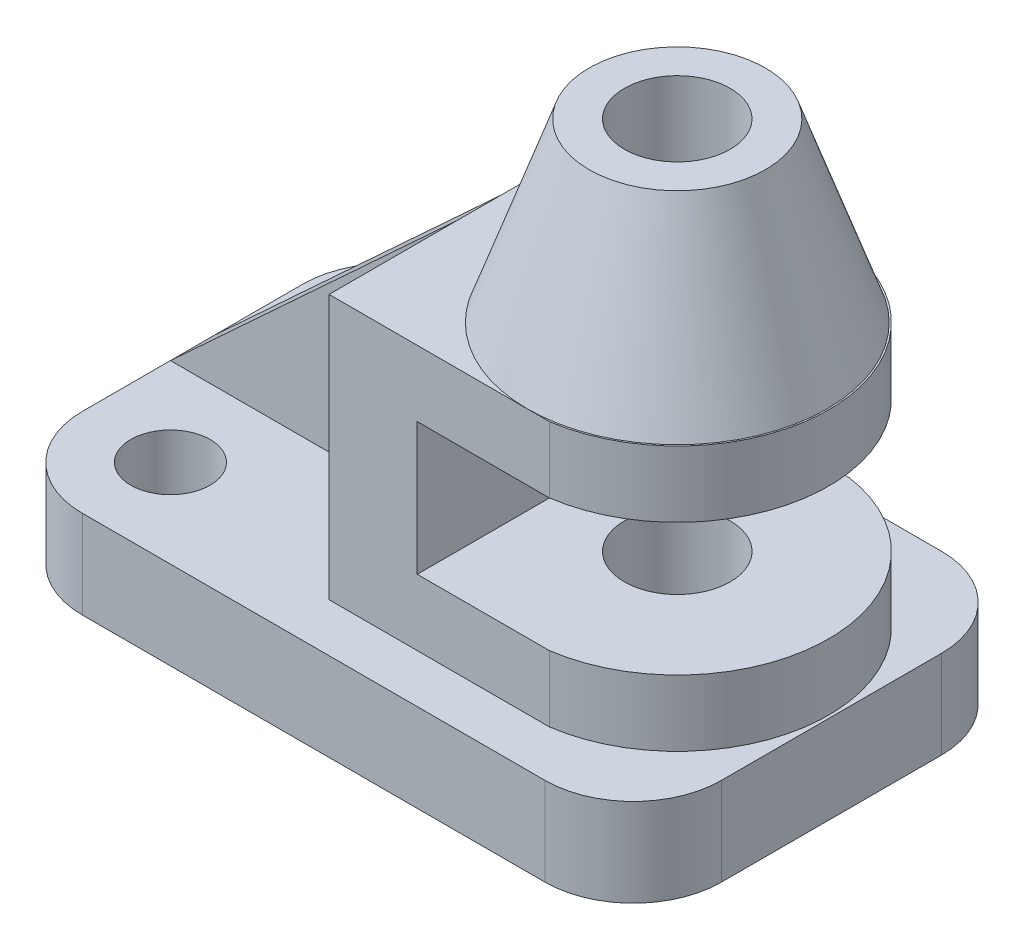
from build123d import *

# Parameters (mm, degrees)
SKETCH1_R           = 9
BOSS_EXTRUDE1_DEPTH = 20
BOSS_EXTRUDE5_DEPTH = 60
BOSS_EXTRUDE8_DEPTH = 60
SKETCH23_R          = 34
SKETCH24_R          = 20
SKETCH25_R          = 12
CUT_EXTRUDE12_DEPTH = 148.245543226
CUT_EXTRUDE13_START = 15
CUT_EXTRUDE13_DEPTH = 30
BOSS_EXTRUDE9_DEPTH = 5


with BuildPart() as part:
    # Sketch1 → Boss-Extrude1 (new body)
    with BuildSketch(Plane(origin=(0, 0, 0), x_dir=(1, 0, 0), z_dir=(0, 1, 0))):
        with BuildLine():
            Line((52.5, 45), (-52.5, 45))
            ThreePointArc((-52.5, 45), (-66.642135624, 39.142135624), (-72.5, 25))
            Line((-72.5, 25), (-72.5, -25))
            ThreePointArc((-72.5, -25), (-66.642135624, -39.142135624), (-52.5, -45))
            Line((-52.5, -45), (52.5, -45))
            ThreePointArc((52.5, -45), (66.642135624, -39.142135624), (72.5, -25))
            Line((72.5, -25), (72.5, 25))
            ThreePointArc((72.5, 25), (66.642135624, 39.142135624), (52.5, 45))
        make_face()
        with Locations((-52.5, 25)):
            Circle(SKETCH1_R, mode=Mode.SUBTRACT)
        with Locations((-52.5, -25)):
            Circle(SKETCH1_R, mode=Mode.SUBTRACT)
    extrude(amount=BOSS_EXTRUDE1_DEPTH)

    # Sketch2 → Boss-Extrude5 (add)
    with BuildSketch(Plane(origin=(0, 20, 0), x_dir=(1, 0, 0), z_dir=(0, 1, 0))):
        Polygon((12.5, 34), (-7.5, 34), (-7.5, 3.870420596), (-7.5, 0), (-7.5, -34), (12.5, -34), align=None)
    extrude(amount=BOSS_EXTRUDE5_DEPTH)

    # Sketch7 → Boss-Extrude8 (add)
    with BuildSketch(Plane(origin=(0, 20, 0), x_dir=(1, 0, 0), z_dir=(0, 1, 0))):
        with BuildLine():
            Line((12.5, -34), (42.5, -34))
            ThreePointArc((42.5, -34), (71.865680555, 0), (42.5, 34))
            Line((42.5, 34), (12.5, 34))
            Line((12.5, 34), (12.5, -34))
        make_face()
    extrude(amount=BOSS_EXTRUDE8_DEPTH)

    # Sketch23 → Loft1 section 0
    with BuildSketch(Plane(origin=(0, 80, 0), x_dir=(1, 0, 0), z_dir=(0, 1, 0))):
        with Locations((37.5, 0)):
            Circle(SKETCH23_R)
    # Sketch24 → Loft1 section 1
    with BuildSketch(Plane(origin=(0, 120, 0), x_dir=(1, 0, 0), z_dir=(0, 1, 0))):
        with Locations((37.5, 0)):
            Circle(SKETCH24_R)
    loft()

    # Sketch25 → Cut-Extrude12 (cut, through all)
    with BuildSketch(Plane(origin=(0, 120, 0), x_dir=(1, 0, 0), z_dir=(0, 1, 0))):
        with Locations((37.5, 0)):
            Circle(SKETCH25_R)
    extrude(amount=-CUT_EXTRUDE12_DEPTH, mode=Mode.SUBTRACT)

    # Sketch7<2> → Cut-Extrude13 (cut)
    with BuildSketch(Plane(origin=(0, 20, 0), x_dir=(1, 0, 0), z_dir=(0, 1, 0)).offset(CUT_EXTRUDE13_START)):
        with BuildLine():
            Line((12.5, -34), (42.5, -34))
            ThreePointArc((42.5, -34), (71.865680555, 0), (42.5, 34))
            Line((42.5, 34), (12.5, 34))
            Line((12.5, 34), (12.5, -34))
        make_face()
    extrude(amount=CUT_EXTRUDE13_DEPTH, mode=Mode.SUBTRACT)

    # Sketch27 → Boss-Extrude9 (add, symmetric)
    with BuildSketch(Plane.XY):
        Polygon((-7.5, 80), (-7.5, 20), (-72.5, 20), align=None)
    extrude(amount=BOSS_EXTRUDE9_DEPTH, both=True)


solid = part.part
